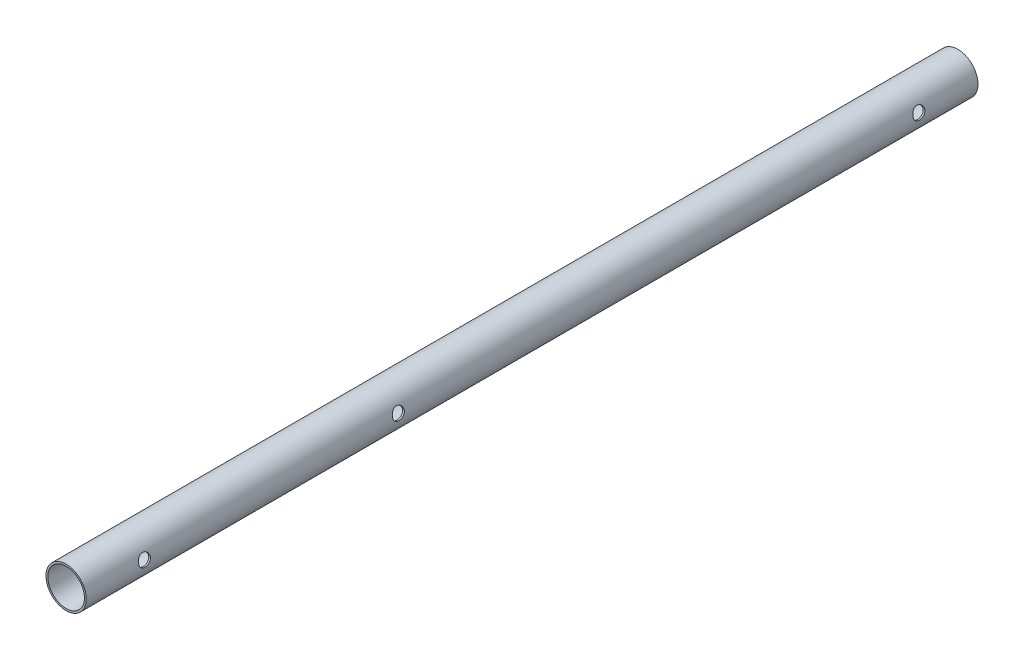
from build123d import *

# Parameters (mm, degrees)
SKETCH1_R           = 11
SKETCH1_R_2         = 10
BOSS_EXTRUDE1_DEPTH = 486.5
SKETCH3_R           = 3.25
CUT_EXTRUDE1_DEPTH  = 488.166931009


with BuildPart() as part:
    # Sketch1 → Boss-Extrude1 (new body)
    with BuildSketch(Plane.XY):
        Circle(SKETCH1_R)
        Circle(SKETCH1_R_2, mode=Mode.SUBTRACT)
    extrude(amount=-BOSS_EXTRUDE1_DEPTH)

    # Sketch3 → Cut-Extrude1 (cut, through all)
    with BuildSketch(Plane(origin=(10.767604694, 2.249152987, 0), x_dir=(0, 0, -1), z_dir=(0.978873153981486, 0.20446845334754707, 0))):
        with Locations(Location((32, 0, 0), (0, 0, 90))):
            Circle(SKETCH3_R)
        with Locations(Location((170.5, 0, 0), (0, 0, 90))):
            Circle(SKETCH3_R)
        with Locations(Location((454.5, 0, 0), (0, 0, 90))):
            Circle(SKETCH3_R)
    extrude(amount=-CUT_EXTRUDE1_DEPTH, mode=Mode.SUBTRACT)


solid = part.part
